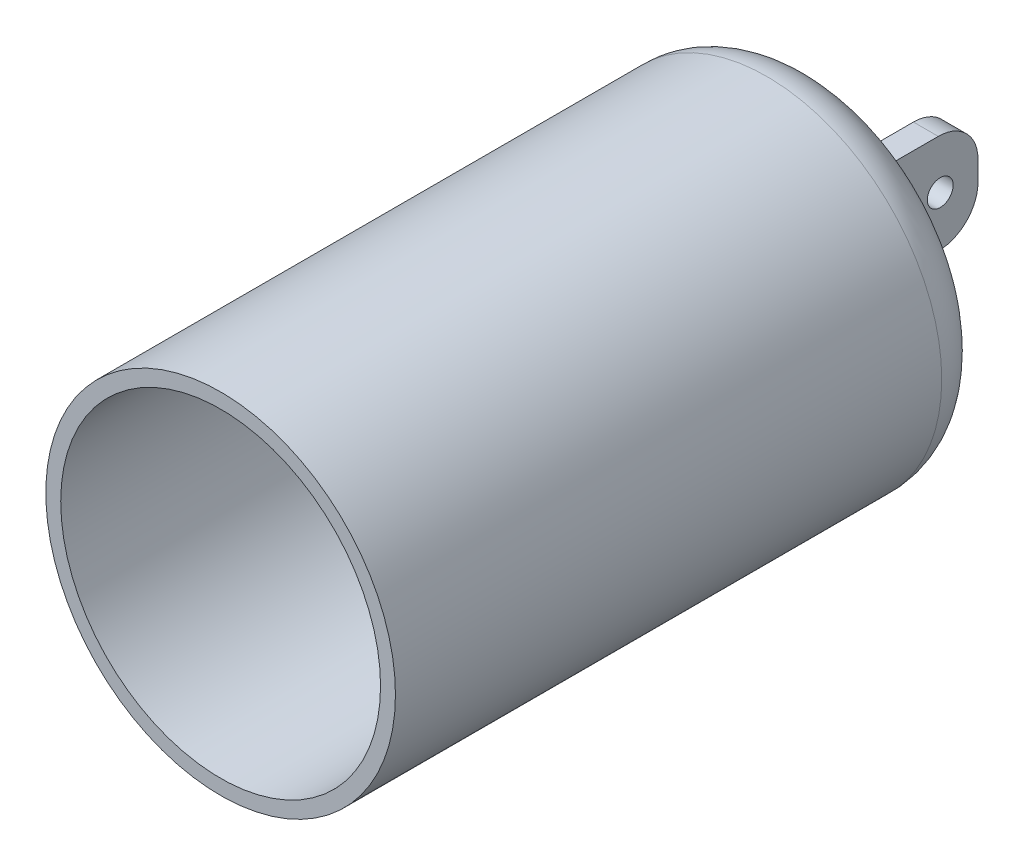
from build123d import *

# Parameters (mm, degrees)
SKETCH1_R           = 176
BOSS_EXTRUDE1_DEPTH = 600
SKETCH2_W           = 25
SKETCH2_H           = 100
BOSS_EXTRUDE2_DEPTH = 150
SKETCH3_R           = 13
CUT_EXTRUDE1_DEPTH  = 654.075990984
FILLET1_R           = 40
FILLET3_R           = 20
FILLET4_R           = 50
SHELL1_T            = -15


with BuildPart() as part:
    # Sketch1 → Boss-Extrude1 (new body)
    with BuildSketch(Plane.XY):
        Circle(SKETCH1_R)
    extrude(amount=BOSS_EXTRUDE1_DEPTH)

    # Sketch2 → Boss-Extrude2 (add)
    with BuildSketch(Plane(origin=(0, 0, 0), x_dir=(-1, 0, 0), z_dir=(0, 0, -1))):
        Rectangle(SKETCH2_W, SKETCH2_H)
    extrude(amount=BOSS_EXTRUDE2_DEPTH)

    # Sketch3 → Cut-Extrude1 (cut, through all)
    with BuildSketch(Plane(origin=(12.5, 0, 0), x_dir=(0, 0, -1), z_dir=(1, 0, 0))):
        with Locations((112, 0)):
            Circle(SKETCH3_R)
    extrude(amount=-CUT_EXTRUDE1_DEPTH, mode=Mode.SUBTRACT)

    # Fillet1
    fillet1_edges = [part.edges().sort_by_distance(p)[0] for p in [
        (0, 50, -150),
        (0, -50, -150),
    ]]
    fillet(fillet1_edges, radius=FILLET1_R)

    # Fillet3
    fillet3_edges = [part.edges().sort_by_distance(p)[0] for p in [
        (12.5, 0, 0),
        (0, -50, 0),
        (-12.5, 0, 0),
        (0, 50, 0),
    ]]
    fillet(fillet3_edges, radius=FILLET3_R)

    # Fillet4
    fillet4_edges = [part.edges().sort_by_distance(p)[0] for p in [
        (-176, 0, 0),
    ]]
    fillet(fillet4_edges, radius=FILLET4_R)

    # Shell1
    shell1_openings = [part.faces().sort_by_distance(p)[0] for p in [
        (0, 0, 600),
    ]]
    offset(amount=SHELL1_T, openings=shell1_openings)


solid = part.part
